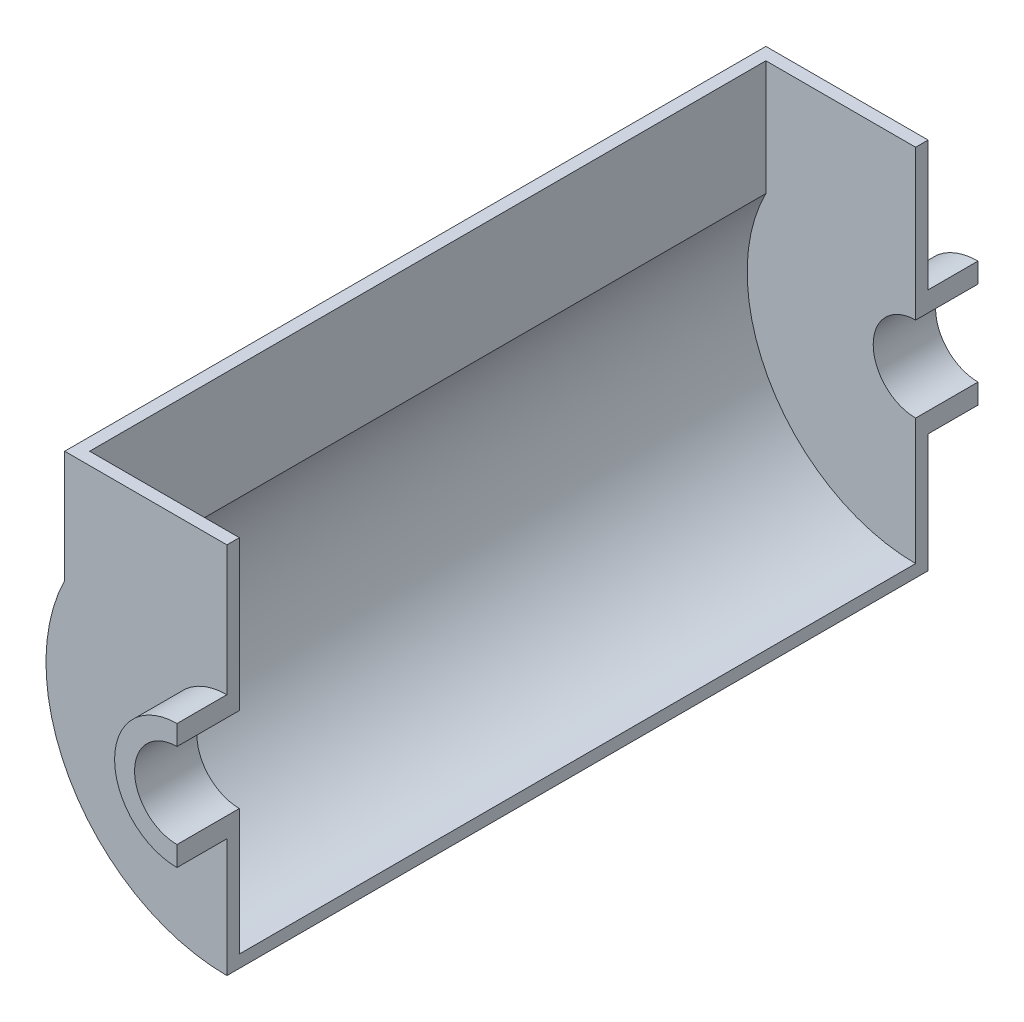
from build123d import *

# Parameters (mm, degrees)
BOSS_EXTRUDE1_DEPTH      = 20
BOSS_EXTRUDE1_DEPTH_BACK = 5
BOSS_EXTRUDE2_START      = -5
BOSS_EXTRUDE2_DEPTH      = 5
BOSS_EXTRUDE3_REACH      = 316.327


with BuildPart() as part:
    # Sketch1 → Boss-Extrude1 (new, two sides: drawn at the far end of the back side and taken through both)
    with BuildSketch(Plane.XY.offset(-BOSS_EXTRUDE1_DEPTH_BACK)):
        with BuildLine():
            Line((0, 25), (0, 17))
            ThreePointArc((0, 17), (-17, 0), (0, -17))
            Line((0, -17), (0, -25))
            ThreePointArc((0, -25), (-25, 0), (0, 25))
        make_face()
    extrude(amount=BOSS_EXTRUDE1_DEPTH + BOSS_EXTRUDE1_DEPTH_BACK)

    # Sketch2 → Boss-Extrude2 (add)
    with BuildSketch(Plane.XY.offset(BOSS_EXTRUDE2_START)):
        with BuildLine():
            Line((0, 25), (0, 77))
            Line((0, 77), (-65, 77))
            Line((-65, 77), (-65, 32.113081447))
            ThreePointArc((-65, 32.113081447), (-61.581037686, -38.262590053), (0, -72.5))
            Line((0, -72.5), (0, -25))
            ThreePointArc((0, -25), (-25, 0), (0, 25))
        make_face()
    extrude(amount=BOSS_EXTRUDE2_DEPTH)


with BuildPart() as body_2:
    # Mirror3: mirrored copy
    add(part.part.mirror(Plane.XY.offset(-140.5)))

    # Sketch3 → Boss-Extrude3 (add, up to next)
    with BuildSketch(Plane(origin=(0, 0, -5), x_dir=(-1, 0, 0), z_dir=(0, 0, -1)), mode=Mode.PRIVATE) as boss_extrude3_sk1:
        with BuildLine():
            Line((65, 77), (65, 32.113081447))
            ThreePointArc((65, 32.113081447), (61.581037686, -38.262590053), (0, -72.5))
            Line((0, -72.5), (0, -67.5))
            ThreePointArc((0, -67.5), (57.634938288, -35.134938288), (60, 30.923292192))
            Line((60, 30.923292192), (60, 77))
            Line((60, 77), (65, 77))
        make_face()
    boss_extrude3_tool1 = extrude(boss_extrude3_sk1.sketch, amount=BOSS_EXTRUDE3_REACH, mode=Mode.PRIVATE) - body_2.part

    add(part.part)  # Boss-Extrude3 merges part
    add(boss_extrude3_tool1.solids().sort_by_distance((-61.66152, 53.961646, -5))[0])


solid = body_2.part
